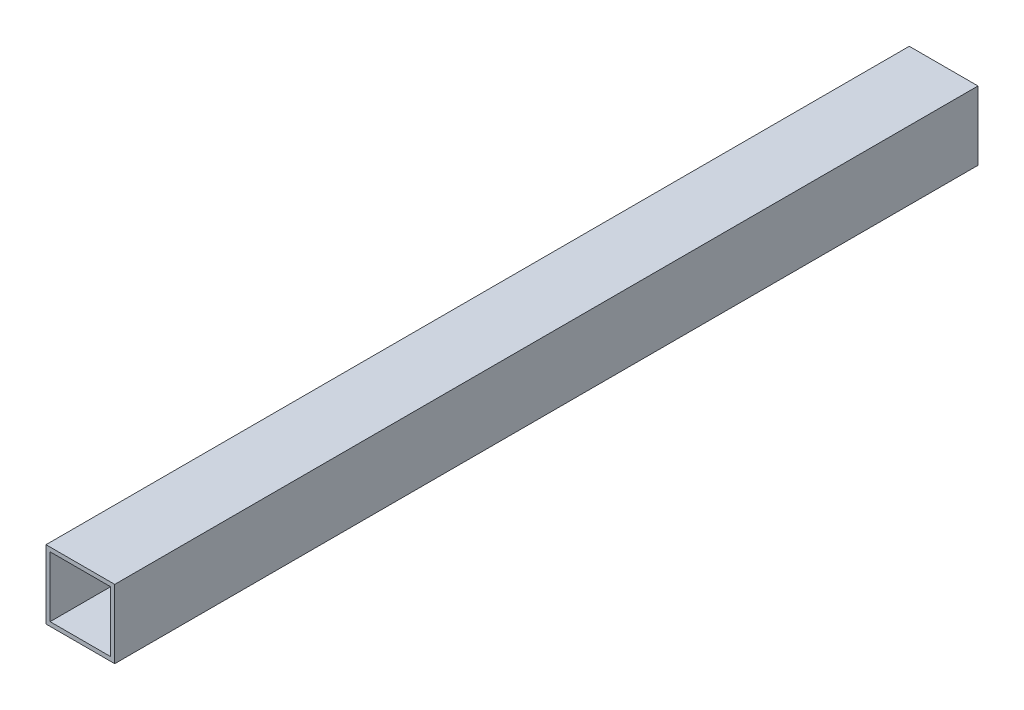
from build123d import *

# Parameters (mm, degrees)
SKETCH_1_W      = 25
SKETCH_1_H      = 25
SKETCH_1_W_2    = 22
SKETCH_1_H_2    = 22
EXTRUDE_1_DEPTH = 314


with BuildPart() as part:
    # Эскиз1 → Вытянуть-Тонкостенный1 (new body)
    with BuildSketch(Plane.XY):
        Rectangle(SKETCH_1_W, SKETCH_1_H)
        Rectangle(SKETCH_1_W_2, SKETCH_1_H_2, mode=Mode.SUBTRACT)
    extrude(amount=EXTRUDE_1_DEPTH)


solid = part.part
